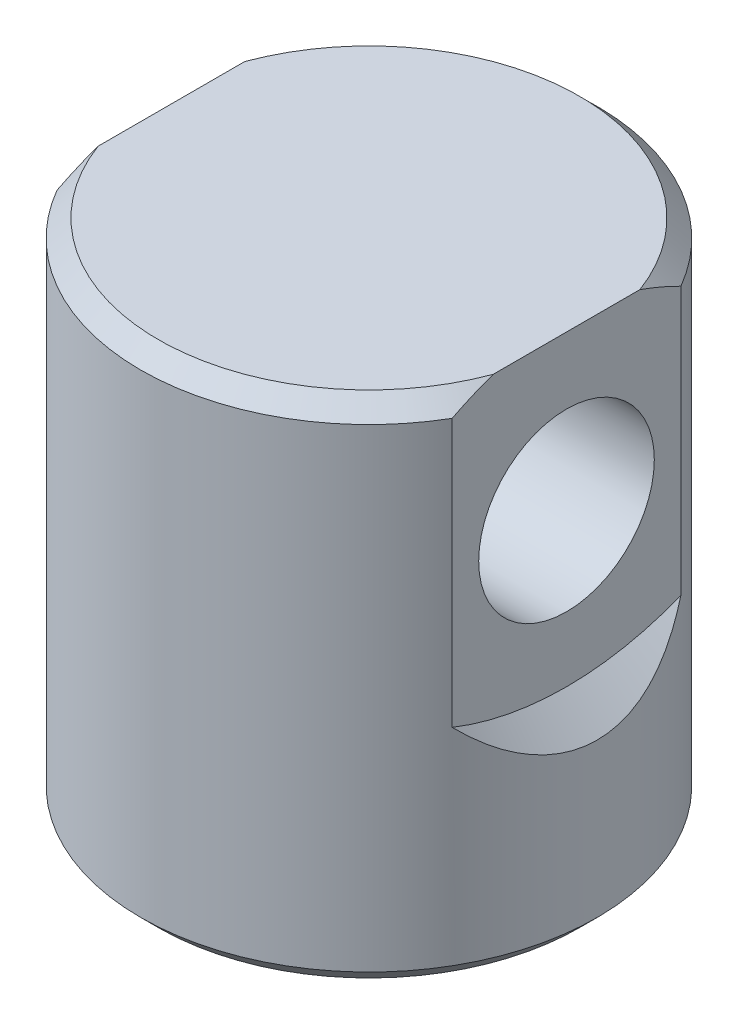
from build123d import *

# Parameters (mm, degrees)
ESQUISSE1_W                  = 13
ESQUISSE1_H                  = 29
ESQUISSE2_R                  = 11.5
ENL_V_MAT_EXTRU_1_DEPTH      = 4
CHANFREIN1_SIZE              = 1
ESQUISSE4_R                  = 8
ENL_V_MAT_EXTRU_2_DEPTH      = 10
ENL_V_MAT_EXTRU_4_DEPTH      = 35.336569502
ENL_V_MAT_EXTRU_4_DEPTH_BACK = 35.336569502
ESQUISSE6_R                  = 5
ENL_V_MAT_EXTRU_5_REACH      = 42.559
ESQUISSE8_R                  = 3


with BuildPart() as part:
    # Esquisse1 → Base-Révolution (revolve)
    with BuildSketch(Plane.XY, mode=Mode.PRIVATE) as base_r_volution_sk:
        with Locations((6.5, 14.5)):
            Rectangle(ESQUISSE1_W, ESQUISSE1_H)
    revolve(base_r_volution_sk.sketch.rotate(Axis((0, 0, 0), (0, 1, 0)), 90), axis=Axis((0, 0, 0), (0, 1, 0)))

    # Esquisse2 → Enlèv. mat.-Extru.1 (cut)
    with BuildSketch(Plane.XZ):
        with Locations(Location((0, 0, 0), (0, 0, 270))):
            Circle(ESQUISSE2_R)
    extrude(amount=-ENL_V_MAT_EXTRU_1_DEPTH, mode=Mode.SUBTRACT)

    # Chanfrein1
    chanfrein1_edges = [part.edges().sort_by_distance(p)[0] for p in [
        (0, 0, 13),
        (0, 29, 13),
    ]]
    chamfer(chanfrein1_edges, length=CHANFREIN1_SIZE)

    # Esquisse3 → Enlèvement de matière-Révolution1 (revolve, cut)
    with BuildSketch(Plane(origin=(0, 0, 0), x_dir=(1, 0, 0), z_dir=(0, 1, 0))):
        Polygon((0, 12.2), (16.5, 12.2), (21.5, 17.2), (0, 17.2), align=None)
    revolve(axis=Axis((0, 0, 0), (0, 0, -1)), mode=Mode.SUBTRACT)

    # Esquisse4 → Enlèv. mat.-Extru.2 (cut)
    with BuildSketch(Plane.XZ.offset(-4)):
        with Locations(Location((0, 0, 0), (0, 0, 270))):
            Circle(ESQUISSE4_R)
    extrude(amount=-ENL_V_MAT_EXTRU_2_DEPTH, mode=Mode.SUBTRACT)

    # Esquisse6 → Enlèv. mat.-Extru.4 (cut, two sides: drawn at the far end of the back side and taken through both)
    with BuildSketch(Plane(origin=(0, 0, 0), x_dir=(0, 0, -1), z_dir=(1, 0, 0)).offset(-ENL_V_MAT_EXTRU_4_DEPTH_BACK)):
        with Locations((0, 20.2)):
            Circle(ESQUISSE6_R)
    extrude(amount=ENL_V_MAT_EXTRU_4_DEPTH + ENL_V_MAT_EXTRU_4_DEPTH_BACK, mode=Mode.SUBTRACT)

    # Esquisse7 → Enlèvement de matière-Révolution2 (revolve, cut)
    with BuildSketch(Plane(origin=(0, 29, 0), x_dir=(-1, 0, 0), z_dir=(0, 1, 0))):
        Polygon((-11.25, 0), (-11.25, 17.5), (-16.25, 22.5), (-16.25, 0), align=None)
        Polygon((11.25, 0), (11.25, 17.5), (16.25, 22.5), (16.25, 0), align=None)
    revolve(axis=Axis((0, 29, 0), (1, 0, 0)), mode=Mode.SUBTRACT)

    # Esquisse8 → Enlèv. mat.-Extru.5 (cut, up to next)
    with BuildSketch(Plane(origin=(0, 0, -12.2), x_dir=(-1, 0, 0), z_dir=(0, 0, -1)), mode=Mode.PRIVATE) as enl_v_mat_extru_5_sk1:
        with Locations((0, 8)):
            Circle(ESQUISSE8_R)
    enl_v_mat_extru_5_tool1 = extrude(enl_v_mat_extru_5_sk1.sketch, amount=-ENL_V_MAT_EXTRU_5_REACH, mode=Mode.PRIVATE) & part.part
    add(enl_v_mat_extru_5_tool1.solids().sort_by_distance((0, 8, -12.2))[0], mode=Mode.SUBTRACT)


solid = part.part
